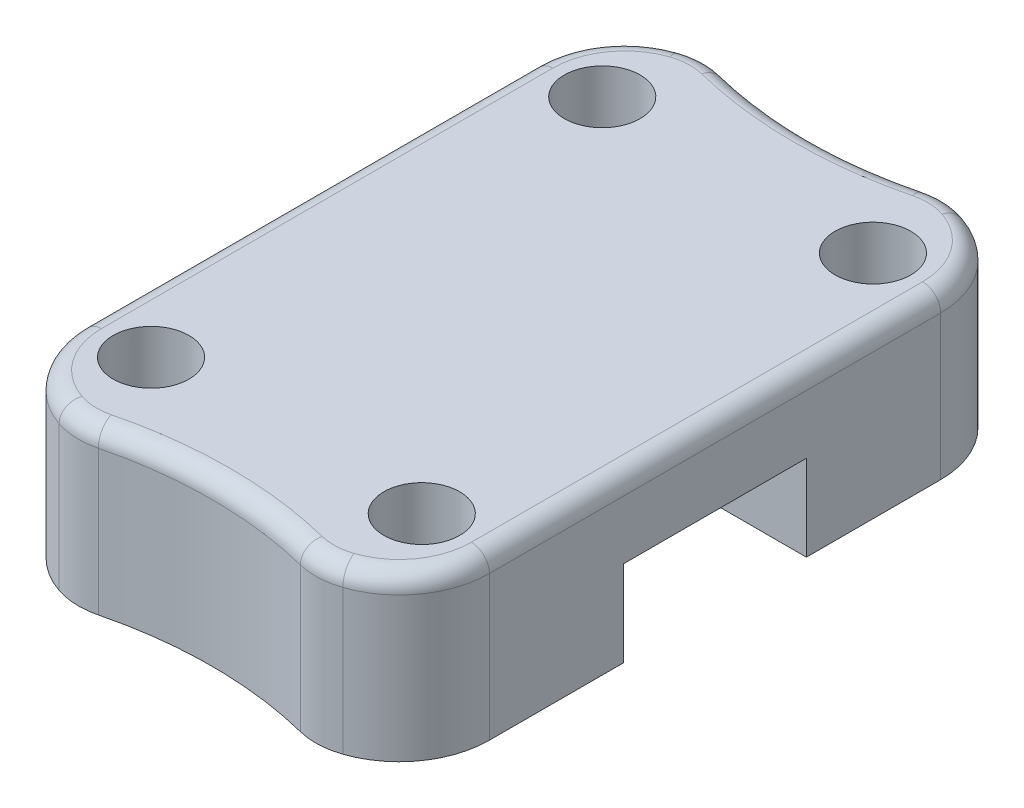
from build123d import *
from OCP.BRepFilletAPI import BRepFilletAPI_MakeChamfer

# Parameters (mm, degrees)
SKETCH1_W               = 45
SKETCH1_H               = 70
BOSS_EXTRUDE1_DEPTH     = 18
CUT_EXTRUDE1_DEPTH      = 60.782940711
CUT_EXTRUDE1_DEPTH_BACK = 60.782940711
SKETCH2_W               = 20.25
SKETCH2_H               = 9.5
SKETCH3_R               = 4.2
CUT_EXTRUDE2_DEPTH      = 46.33486517
FILLET1_R               = 10
CUT_EXTRUDE3_DEPTH      = 46.33486517
FILLET2_R               = 8
FILLET4_R               = 2
CHAMFER1_SIZE           = 0.5
CHAMFER1_SIZE2          = 1.37373871


with BuildPart() as part:
    # Sketch1 → Boss-Extrude1 (new body)
    with BuildSketch(Plane(origin=(0, 0, 0), x_dir=(1, 0, 0), z_dir=(0, 1, 0))):
        Rectangle(SKETCH1_W, SKETCH1_H)
    extrude(amount=BOSS_EXTRUDE1_DEPTH)

    # Sketch2 → Cut-Extrude1 (cut, two sides: drawn at the far end of the back side and taken through both)
    with BuildSketch(Plane(origin=(22.5, 0, 0), x_dir=(0, 0, -1), z_dir=(1, 0, 0)).offset(-CUT_EXTRUDE1_DEPTH_BACK)):
        with Locations((0, 4.75)):
            Rectangle(SKETCH2_W, SKETCH2_H)
    extrude(amount=CUT_EXTRUDE1_DEPTH + CUT_EXTRUDE1_DEPTH_BACK, mode=Mode.SUBTRACT)

    # Sketch3 → Cut-Extrude2 (cut, through all)
    with BuildSketch(Plane.XZ):
        with Locations(Location((15, 25, 0), (0, 0, 270))):
            Circle(SKETCH3_R)
        with Locations(Location((15, -25, 0), (0, 0, 270))):
            Circle(SKETCH3_R)
        with Locations(Location((-15, -25, 0), (0, 0, 270))):
            Circle(SKETCH3_R)
        with Locations(Location((-15, 25, 0), (0, 0, 270))):
            Circle(SKETCH3_R)
    extrude(amount=-CUT_EXTRUDE2_DEPTH, mode=Mode.SUBTRACT)

    # Fillet1
    fillet1_edges = [part.edges().sort_by_distance(p)[0] for p in [
        (-22.5, 9, -35),
        (22.5, 9, -35),
        (22.5, 9, 35),
        (-22.5, 9, 35),
    ]]
    fillet(fillet1_edges, radius=FILLET1_R)

    # Sketch6 → Cut-Extrude3 (cut, through all)
    with BuildSketch(Plane.XZ):
        with BuildLine():
            Line((12.5, 35), (-12.5, 35))
            ThreePointArc((-12.5, 35), (0, 33.26906369), (12.5, 35))
        make_face()
        with BuildLine():
            Line((12.5, -35), (-12.5, -35))
            ThreePointArc((-12.5, -35), (0, -33.26906369), (12.5, -35))
        make_face()
    extrude(amount=-CUT_EXTRUDE3_DEPTH, mode=Mode.SUBTRACT)

    # Fillet2
    fillet2_edges = [part.edges().sort_by_distance(p)[0] for p in [
        (12.5, 9, 35),
        (-12.5, 9, 35),
        (12.5, 9, -35),
        (-12.5, 9, -35),
    ]]
    fillet(fillet2_edges, radius=FILLET2_R)

    # Fillet4
    fillet4_edges = [part.edges().sort_by_distance(p)[0] for p in [
        (-22.5, 18, 0),
        (22.5, 18, 0),
        (20.63102045, 18, -30.821211768),
        (-20.63102045, 18, 30.821211768),
        (0, 18, 33.26906369),
        (20.63102045, 18, 30.821211768),
        (0, 18, -33.26906369),
        (-20.63102045, 18, -30.821211768),
        (13.473401565, 18, -34.886533438),
        (-13.473401565, 18, -34.886533438),
        (-13.473401565, 18, 34.886533438),
        (13.473401565, 18, 34.886533438),
    ]]
    fillet(fillet4_edges, radius=FILLET4_R)

    # Chamfer1: one chamfer whose edges measure the first distance from different faces: ONE call of the kernel's chamfer builder (chamfer() names one face for all edges)
    chamfer1_edges_1 = [part.edges().sort_by_distance(p)[0] for p in [
        (-15, 0, -20.8),
        (15, 0, -20.8),
    ]]
    chamfer1_side_1 = [part.faces().sort_by_distance(p)[0] for p in [
        (0, 0, -21.437561791),
    ]]
    chamfer1_edges_2 = [part.edges().sort_by_distance(p)[0] for p in [
        (-15, 0, 29.2),
        (15, 0, 29.2),
    ]]
    chamfer1_side_2 = [part.faces().sort_by_distance(p)[0] for p in [
        (0, 0, 21.437561791),
    ]]
    chamfer1 = BRepFilletAPI_MakeChamfer(part.part.solid().wrapped)
    for e in chamfer1_edges_1:
        chamfer1.Add(CHAMFER1_SIZE, CHAMFER1_SIZE2, e.wrapped, chamfer1_side_1[0].wrapped)  # the first distance lies on this face
    for e in chamfer1_edges_2:
        chamfer1.Add(CHAMFER1_SIZE, CHAMFER1_SIZE2, e.wrapped, chamfer1_side_2[0].wrapped)  # the first distance lies on this face
    add(Compound.cast(chamfer1.Shape()), mode=Mode.REPLACE)


solid = part.part
